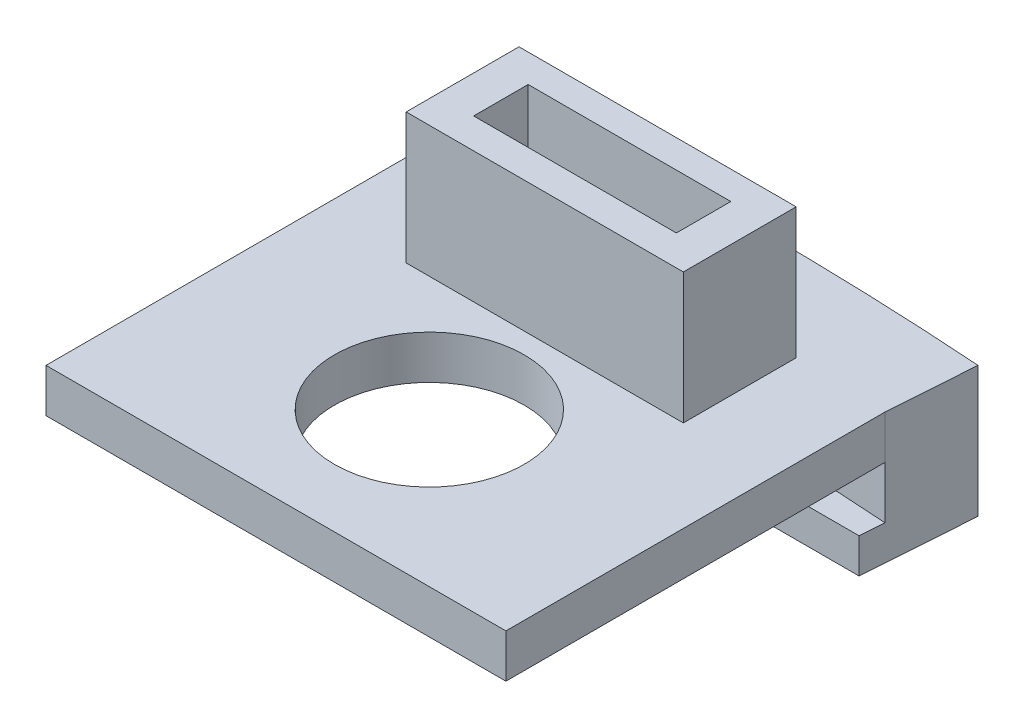
from build123d import *

# Parameters (mm, degrees)
SKETCH1_R           = 5.53085
SKETCH1_W           = 11.811
SKETCH1_H           = 3.175
BOSS_EXTRUDE1_DEPTH = 2.54
SKETCH1_3_W         = 16.150142566
SKETCH1_3_H         = 6.574737844
BOSS_EXTRUDE2_DEPTH = 10.16
BOSS_EXTRUDE3_START = -5.08
BOSS_EXTRUDE3_DEPTH = 5.08
BOSS_EXTRUDE5_DEPTH = 2.032


with BuildPart() as part:
    # Sketch1 → Boss-Extrude1 (new body)
    with BuildSketch(Plane(origin=(0, 0, 0), x_dir=(1, 0, 0), z_dir=(0, 1, 0))):
        with BuildLine():
            ThreePointArc((13.753578899, 4.597841674), (0, 5.078127233), (-13.753578899, 4.597841674))
            Line((-13.753578899, 4.597841674), (-13.39934665, -0.467915496))
            Line((-13.39934665, -0.467915496), (-13.39934665, -22.557024998))
            Line((-13.39934665, -22.557024998), (13.39934665, -22.557024998))
            Line((13.39934665, -22.557024998), (13.39934665, -0.467915496))
            Line((13.39934665, -0.467915496), (13.753578899, 4.597841674))
        make_face()
        with Locations((0, -13.62075)):
            Circle(SKETCH1_R, mode=Mode.SUBTRACT)
        with Locations((0, -3.5433)):
            Rectangle(SKETCH1_W, SKETCH1_H, mode=Mode.SUBTRACT)
    extrude(amount=BOSS_EXTRUDE1_DEPTH)

    # Sketch1<3> → Boss-Extrude2 (add)
    with BuildSketch(Plane(origin=(0, 0, 0), x_dir=(1, 0, 0), z_dir=(0, 1, 0))):
        with Locations((0, -3.6068)):
            Rectangle(SKETCH1_3_W, SKETCH1_3_H)
        Polygon((0, -5.1308), (-5.9055, -5.1308), (-5.9055, -1.9558), (5.9055, -1.9558), (5.9055, -5.1308), align=None, mode=Mode.SUBTRACT)
    extrude(amount=BOSS_EXTRUDE2_DEPTH)

    # Sketch1<4> → Boss-Extrude3 (add)
    with BuildSketch(Plane(origin=(0, 0, 0), x_dir=(1, 0, 0), z_dir=(0, 1, 0)).offset(BOSS_EXTRUDE3_START)):
        with BuildLine():
            ThreePointArc((13.753578899, 4.597841674), (0, 5.078127233), (-13.753578899, 4.597841674))
            Line((-13.753578899, 4.597841674), (-13.39934665, -0.467915496))
            ThreePointArc((-13.39934665, -0.467915496), (-6.703757073, -0.117014515), (0, 0))
            ThreePointArc((0, 0), (6.703757073, -0.117014515), (13.39934665, -0.467915496))
            Line((13.39934665, -0.467915496), (13.753578899, 4.597841674))
        make_face()
    extrude(amount=BOSS_EXTRUDE3_DEPTH)

    # Sketch2 → Boss-Extrude5 (add)
    with BuildSketch(Plane.XZ.offset(5.08)):
        Polygon((-13.753578899, -4.597841674), (-13.39934665, 0.467915496), (-13.300671129, 1.879041191), (13.300671129, 1.879041191), (13.39934665, 0.467915496), (13.753578899, -4.597841674), align=None)
    extrude(amount=-BOSS_EXTRUDE5_DEPTH)


solid = part.part
